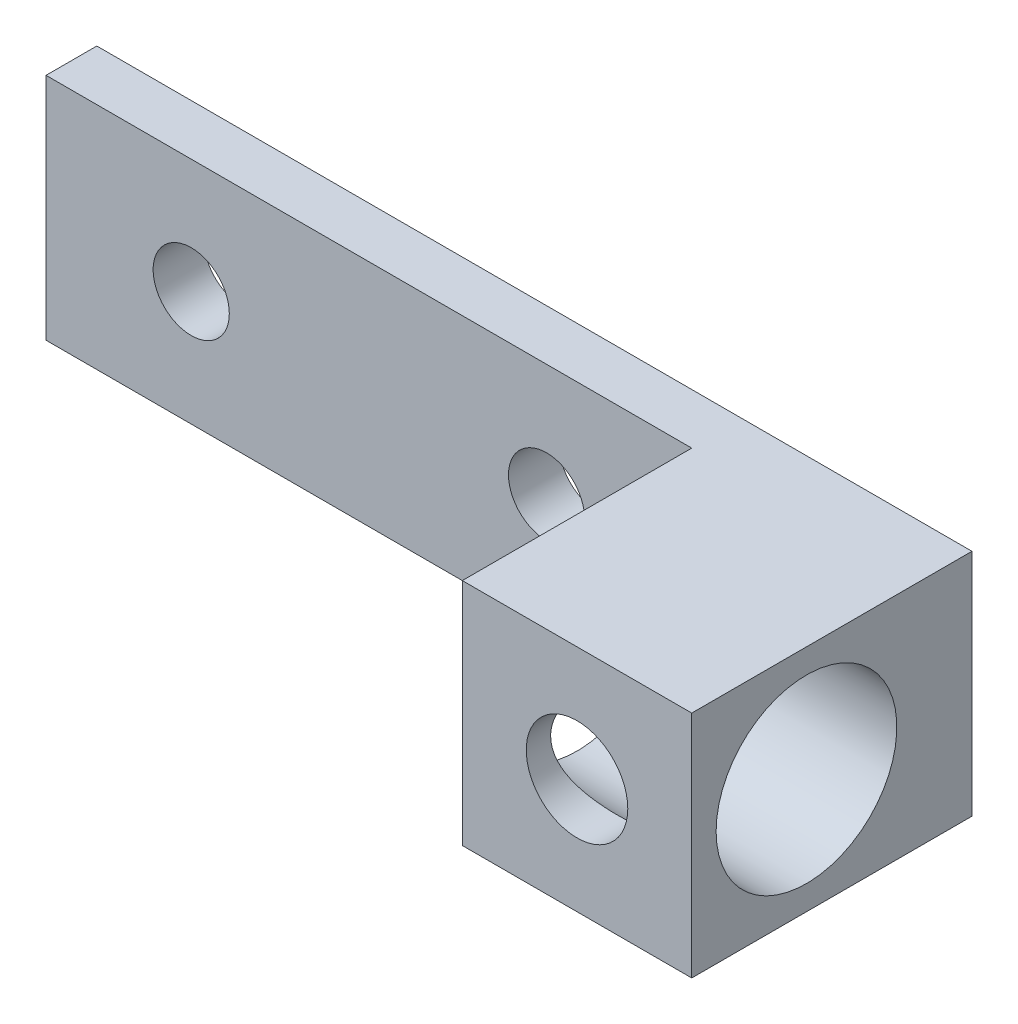
from build123d import *

# Parameters (mm, degrees)
EXTRUDE1_DEPTH = 28.702
SKETCH2_R      = 11.303
EXTRUDE2_DEPTH = 93.609737566
SKETCH3_R      = 6.35
EXTRUDE3_DEPTH = 12.7
SKETCH4_R      = 4.7625
EXTRUDE4_DEPTH = 117.756868277


with BuildPart() as part:
    # Sketch1 → Extrude1 (new body)
    with BuildSketch(Plane(origin=(0, 0, 0), x_dir=(1, 0, 0), z_dir=(0, 1, 0))):
        Polygon((0, 0), (0, -35.052), (-28.702, -35.052), (-28.702, -6.35), (-109.474, -6.35), (-109.474, 0), align=None)
    extrude(amount=EXTRUDE1_DEPTH)

    # Sketch2 → Extrude2 (cut, through all)
    with BuildSketch(Plane.ZY.offset(28.702)):
        with Locations((20.701, 14.351)):
            Circle(SKETCH2_R)
    extrude(amount=-EXTRUDE2_DEPTH, mode=Mode.SUBTRACT)

    # Sketch3 → Extrude3 (cut)
    with BuildSketch(Plane.XY.offset(35.052)):
        with Locations((-14.351, 14.351)):
            Circle(SKETCH3_R)
    extrude(amount=-EXTRUDE3_DEPTH, mode=Mode.SUBTRACT)

    # Sketch4 → Extrude4 (cut, through all)
    with BuildSketch(Plane.XY.offset(6.35)):
        with Locations((-91.313, 14.351)):
            Circle(SKETCH4_R)
        with Locations(Location((-46.863, 14.351, 0), (0, 0, 180))):
            Circle(SKETCH4_R)
    extrude(amount=-EXTRUDE4_DEPTH, mode=Mode.SUBTRACT)


solid = part.part
